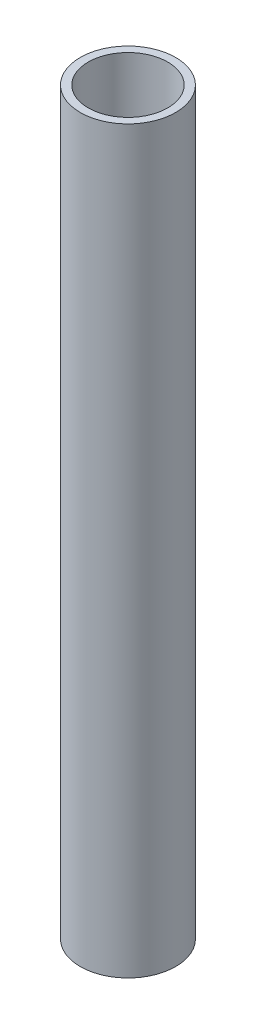
from build123d import *

# Parameters (mm, degrees)
SKETCH1_R           = 6
SKETCH1_R_2         = 5
BOSS_EXTRUDE1_DEPTH = 93


with BuildPart() as part:
    # Sketch1 → Boss-Extrude1 (new body)
    with BuildSketch(Plane(origin=(0, 0, 0), x_dir=(1, 0, 0), z_dir=(0, 1, 0))):
        with Locations(Location((0, 0, 0), (0, 0, 270))):
            Circle(SKETCH1_R)
        with Locations(Location((0, 0, 0), (0, 0, 270))):
            Circle(SKETCH1_R_2, mode=Mode.SUBTRACT)
    extrude(amount=BOSS_EXTRUDE1_DEPTH)


solid = part.part
